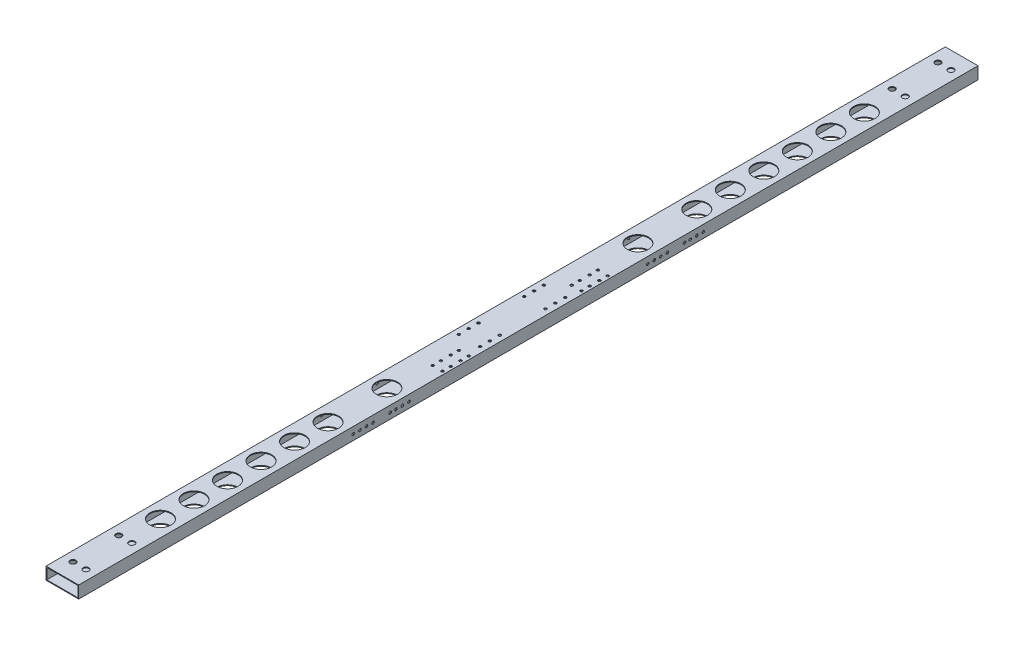
from build123d import *

# Parameters (mm, degrees)
SKETCH_1_W          = 40
SKETCH_1_H          = 15
SKETCH_1_W_2        = 38
SKETCH_1_H_2        = 13
EXTRUDE_1_DEPTH     = 1100
SKETCH_2_R          = 3.575
SKETCH_2_R_2        = 1.6
CUT_EXTRUDE_1_DEPTH = 1101.829232897
SKETCH_3_R          = 1.575
CUT_EXTRUDE_2_DEPTH = 1101.829232897
SKETCH_6_R          = 13
CUT_EXTRUDE_4_DEPTH = 1101.829232897
SKETCH_7_R          = 1.6
CUT_EXTRUDE_5_DEPTH = 1101.829232897


with BuildPart() as part:
    # 草图1 → 凸台-拉伸1 (new body)
    with BuildSketch(Plane.XY):
        with Locations((20, 7.5)):
            Rectangle(SKETCH_1_W, SKETCH_1_H)
        with Locations((20, 7.5)):
            Rectangle(SKETCH_1_W_2, SKETCH_1_H_2, mode=Mode.SUBTRACT)
    extrude(amount=EXTRUDE_1_DEPTH)

    # 草图2 → 切除-拉伸1 (cut, through all)
    with BuildSketch(Plane(origin=(0, 15, 0), x_dir=(1, 0, 0), z_dir=(0, 1, 0))):
        with Locations((12, -21)):
            Circle(SKETCH_2_R)
        with Locations((28, -21)):
            Circle(SKETCH_2_R)
        with Locations((33, -498)):
            Circle(SKETCH_2_R_2)
        with Locations((7, -522)):
            Circle(SKETCH_2_R_2)
        with Locations((33, -522)):
            Circle(SKETCH_2_R_2)
        with Locations((7, -590)):
            Circle(SKETCH_2_R_2)
        with Locations((7, -510)):
            Circle(SKETCH_2_R_2)
        with Locations((33, -590)):
            Circle(SKETCH_2_R_2)
        with Locations((33, -510)):
            Circle(SKETCH_2_R_2)
        with Locations((7, -602)):
            Circle(SKETCH_2_R_2)
        with Locations((33, -602)):
            Circle(SKETCH_2_R_2)
        with Locations((7, -498)):
            Circle(SKETCH_2_R_2)
        with Locations((7, -578)):
            Circle(SKETCH_2_R_2)
        with Locations((33, -578)):
            Circle(SKETCH_2_R_2)
        with Locations((12, -77)):
            Circle(SKETCH_2_R)
        with Locations((28, -77)):
            Circle(SKETCH_2_R)
        with Locations((12, -1023)):
            Circle(SKETCH_2_R)
        with Locations((28, -1023)):
            Circle(SKETCH_2_R)
        with Locations((28, -1079)):
            Circle(SKETCH_2_R)
        with Locations((12, -1079)):
            Circle(SKETCH_2_R)
    extrude(amount=-CUT_EXTRUDE_1_DEPTH, mode=Mode.SUBTRACT)

    # 草图3 → 切除-拉伸2 (cut, through all)
    with BuildSketch(Plane(origin=(0, 15, 0), x_dir=(1, 0, 0), z_dir=(0, 1, 0))):
        with Locations((24, -629)):
            Circle(SKETCH_3_R)
        with Locations((36, -629)):
            Circle(SKETCH_3_R)
        with Locations((24, -619)):
            Circle(SKETCH_3_R)
        with Locations((36, -619)):
            Circle(SKETCH_3_R)
        with Locations((36, -641)):
            Circle(SKETCH_3_R)
        with Locations((24, -641)):
            Circle(SKETCH_3_R)
        with Locations((24, -651)):
            Circle(SKETCH_3_R)
        with Locations((36, -651)):
            Circle(SKETCH_3_R)
        with Locations((24, -471)):
            Circle(SKETCH_3_R)
        with Locations((36, -471)):
            Circle(SKETCH_3_R)
        with Locations((24, -481)):
            Circle(SKETCH_3_R)
        with Locations((36, -481)):
            Circle(SKETCH_3_R)
        with Locations((36, -459)):
            Circle(SKETCH_3_R)
        with Locations((24, -459)):
            Circle(SKETCH_3_R)
        with Locations((24, -449)):
            Circle(SKETCH_3_R)
        with Locations((36, -449)):
            Circle(SKETCH_3_R)
    extrude(amount=-CUT_EXTRUDE_2_DEPTH, mode=Mode.SUBTRACT)

    # 草图6 → 切除-拉伸4 (cut, through all)
    with BuildSketch(Plane.XZ):
        with Locations((20, 980)):
            Circle(SKETCH_6_R)
        with Locations((20, 939)):
            Circle(SKETCH_6_R)
        with Locations((20, 898)):
            Circle(SKETCH_6_R)
        with Locations((20, 857)):
            Circle(SKETCH_6_R)
        with Locations((20, 816)):
            Circle(SKETCH_6_R)
        with Locations((20, 775)):
            Circle(SKETCH_6_R)
        with Locations((20, 324)):
            Circle(SKETCH_6_R)
        with Locations((20, 283)):
            Circle(SKETCH_6_R)
        with Locations((20, 242)):
            Circle(SKETCH_6_R)
        with Locations((20, 201)):
            Circle(SKETCH_6_R)
        with Locations((20, 160)):
            Circle(SKETCH_6_R)
        with Locations((20, 119)):
            Circle(SKETCH_6_R)
        with Locations((20, 703)):
            Circle(SKETCH_6_R)
        with Locations((20, 396)):
            Circle(SKETCH_6_R)
    extrude(amount=-CUT_EXTRUDE_4_DEPTH, mode=Mode.SUBTRACT)

    # 草图7 → 切除-拉伸5 (cut, through all)
    with BuildSketch(Plane.ZY):
        with Locations((336, 7)):
            Circle(SKETCH_7_R)
        with Locations((380, 7)):
            Circle(SKETCH_7_R)
        with Locations((388, 7)):
            Circle(SKETCH_7_R)
        with Locations((396, 7)):
            Circle(SKETCH_7_R)
        with Locations((404, 7)):
            Circle(SKETCH_7_R)
        with Locations((359, 7)):
            Circle(SKETCH_7_R)
        with Locations((352, 7)):
            Circle(SKETCH_7_R)
        with Locations((344, 7)):
            Circle(SKETCH_7_R)
        with Locations((696, 7)):
            Circle(SKETCH_7_R)
        with Locations((740, 7)):
            Circle(SKETCH_7_R)
        with Locations((748, 7)):
            Circle(SKETCH_7_R)
        with Locations((756, 7)):
            Circle(SKETCH_7_R)
        with Locations((764, 7)):
            Circle(SKETCH_7_R)
        with Locations((719, 7)):
            Circle(SKETCH_7_R)
        with Locations((712, 7)):
            Circle(SKETCH_7_R)
        with Locations((704, 7)):
            Circle(SKETCH_7_R)
    extrude(amount=-CUT_EXTRUDE_5_DEPTH, mode=Mode.SUBTRACT)


solid = part.part
